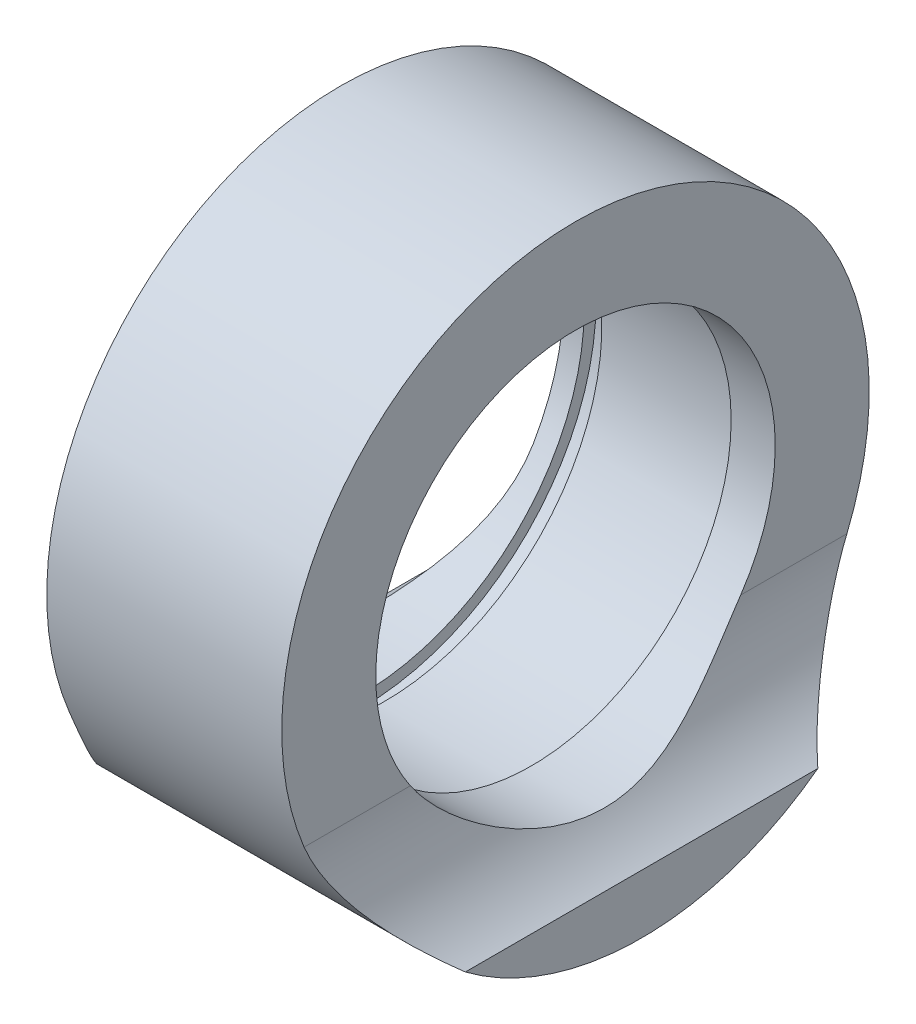
from build123d import *

# Parameters (mm, degrees)
CUT_EXTRUDE1_DEPTH      = 24.970724332
CUT_EXTRUDE1_DEPTH_BACK = 24.970724332


with BuildPart() as part:
    # Sketch2 → Revolve1 (revolve)
    with BuildSketch(Plane(origin=(0, 0, 0), x_dir=(1, 0, 0), z_dir=(0, 1, 0)), mode=Mode.PRIVATE) as revolve1_sk:
        Polygon((4.7625, 9.398), (11.1125, 9.398), (11.1125, 8.636), (15.875, 8.636), (15.875, 12.7), (0, 12.7), (0, 9.652), (3.7465, 9.652), (3.7465, 10.16), (4.7625, 10.16), align=None)
    revolve(revolve1_sk.sketch.rotate(Axis((0, 0, 0), (1, 0, 0)), 180), axis=Axis((0, 0, 0), (1, 0, 0)))

    # Sketch6 → Cut-Extrude1 (cut, two sides: drawn at the far end of the back side and taken through both)
    with BuildSketch(Plane.XY.offset(-CUT_EXTRUDE1_DEPTH_BACK)):
        with BuildLine():
            Line((0, 12.7), (0, -10.16))
            ThreePointArc((0, -10.16), (2.097664354, -7.868773916), (2.8575, -4.856704444))
            Line((2.8575, -4.856704444), (2.8575, 12.7))
            Line((2.8575, 12.7), (0, 12.7))
        make_face()
        with BuildLine():
            ThreePointArc((15.875, -10.16), (13.777335646, -7.868773916), (13.0175, -4.856704444))
            Line((13.0175, -4.856704444), (13.0175, 12.7))
            Line((13.0175, 12.7), (15.875, 12.7))
            Line((15.875, 12.7), (15.875, -10.16))
        make_face()
    extrude(amount=CUT_EXTRUDE1_DEPTH + CUT_EXTRUDE1_DEPTH_BACK, mode=Mode.SUBTRACT)


solid = part.part
